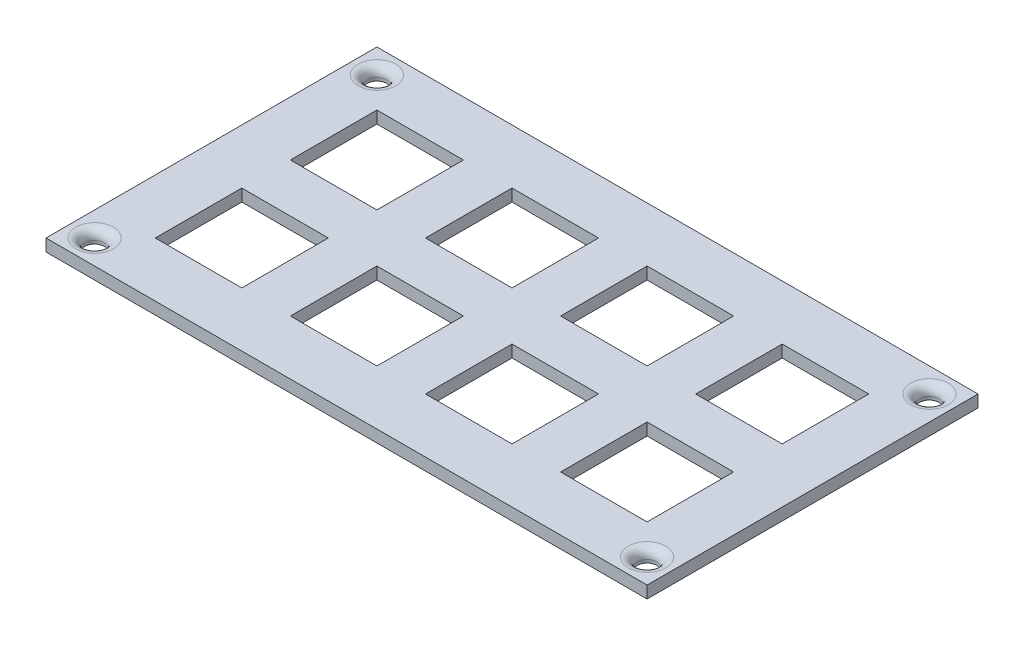
from build123d import *

# Parameters (mm, degrees)
SKETCH1_W           = 99
SKETCH1_H           = 54.5
SKETCH1_R           = 1.6
SKETCH1_W_2         = 14.25
SKETCH1_H_2         = 14.25
BOSS_EXTRUDE1_DEPTH = 2
FILLET1_R           = 1.5


with BuildPart() as part:
    # Sketch1 → Boss-Extrude1 (new body)
    with BuildSketch(Plane(origin=(0, 0, 0), x_dir=(1, 0, 0), z_dir=(0, 1, 0))):
        Rectangle(SKETCH1_W, SKETCH1_H)
        with Locations(Location((-45.5, 23.25, 0), (0, 0, 270))):
            Circle(SKETCH1_R, mode=Mode.SUBTRACT)
        with Locations(Location((45.5, 23.25, 0), (0, 0, 90))):
            Circle(SKETCH1_R, mode=Mode.SUBTRACT)
        with Locations(Location((45.5, -23.25, 0), (0, 0, 270))):
            Circle(SKETCH1_R, mode=Mode.SUBTRACT)
        with Locations(Location((-45.5, -23.25, 0), (0, 0, 90))):
            Circle(SKETCH1_R, mode=Mode.SUBTRACT)
        with Locations((-33.375, 11.125)):
            Rectangle(SKETCH1_W_2, SKETCH1_H_2, mode=Mode.SUBTRACT)
        with Locations((-11.125, 11.125)):
            Rectangle(SKETCH1_W_2, SKETCH1_H_2, mode=Mode.SUBTRACT)
        with Locations((11.125, 11.125)):
            Rectangle(SKETCH1_W_2, SKETCH1_H_2, mode=Mode.SUBTRACT)
        with Locations((33.375, 11.125)):
            Rectangle(SKETCH1_W_2, SKETCH1_H_2, mode=Mode.SUBTRACT)
        with Locations((33.375, -11.125)):
            Rectangle(SKETCH1_W_2, SKETCH1_H_2, mode=Mode.SUBTRACT)
        with Locations((11.125, -11.125)):
            Rectangle(SKETCH1_W_2, SKETCH1_H_2, mode=Mode.SUBTRACT)
        with Locations((-11.125, -11.125)):
            Rectangle(SKETCH1_W_2, SKETCH1_H_2, mode=Mode.SUBTRACT)
        with Locations((-33.375, -11.125)):
            Rectangle(SKETCH1_W_2, SKETCH1_H_2, mode=Mode.SUBTRACT)
    extrude(amount=BOSS_EXTRUDE1_DEPTH)

    # Fillet1
    fillet1_edges = [part.edges().sort_by_distance(p)[0] for p in [
        (-45.5, 2, -24.85),
        (45.5, 2, -21.65),
        (45.5, 2, 21.65),
        (-45.5, 2, 24.85),
    ]]
    fillet(fillet1_edges, radius=FILLET1_R)


solid = part.part
